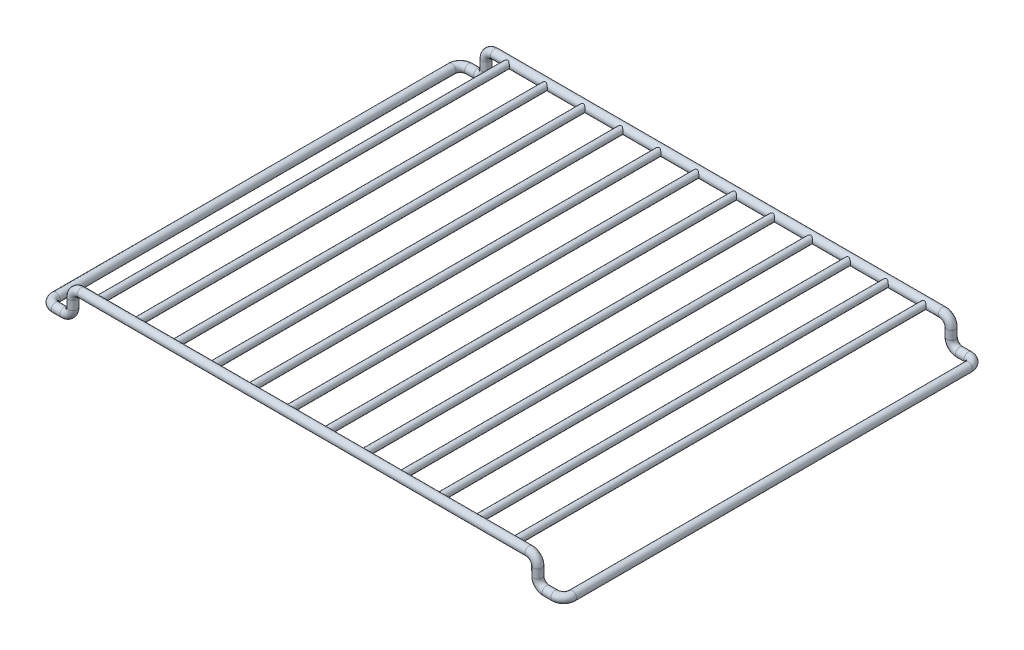
from build123d import *

# Parameters (mm, degrees)
SKETCH1_R                = 2.5
BOSS_EXTRUDE1_REACH      = 289
BOSS_EXTRUDE1_END_RADIUS = 2.5
SKETCH2_R                = 2
LPATTERN1_COUNT          = 6
LPATTERN1_PITCH          = 22


with BuildPart() as part:
    # Sweep1: sweep along a curve in space
    with BuildLine() as sweep1_path:
        Line((0, 0, 0), (130, 0, 0))
        ThreePointArc((130, 0, 0), (133.535533906, -1.464466094, 0), (135, -5, 0))
        Line((135, -5, 0), (135, -10, 0))
        ThreePointArc((135, -10, 0), (136.464466094, -13.535533906, 0), (140, -15, 0))
        Line((140, -15, 0), (145, -15, 0))
        ThreePointArc((145, -15, 0), (148.535533906, -15, 1.464466094), (150, -15, 5))
        Line((150, -15, 5), (150, -15, 235))
        ThreePointArc((150, -15, 235), (148.535533906, -15, 238.535533906), (145, -15, 240))
        Line((145, -15, 240), (140, -15, 240))
        ThreePointArc((140, -15, 240), (136.464466094, -13.535533906, 240), (135, -10, 240))
        Line((135, -10, 240), (135, -5, 240))
        ThreePointArc((135, -5, 240), (133.535533906, -1.464466094, 240), (130, 0, 240))
        Line((130, 0, 240), (0, 0, 240))
    # Sketch1 → Sweep1 (sweep)
    with BuildSketch(Plane(origin=(0, 0, 0), x_dir=(0, 0, -1), z_dir=(1, 0, 0))):
        Circle(SKETCH1_R)
    sweep(path=sweep1_path.line)

    # Boss-Extrude1: up to this cylinder (the profile starts outside it)
    boss_extrude1_end = Plane(origin=(11, 0, 240), z_dir=(-1, 0, 0)) * Cylinder(BOSS_EXTRUDE1_END_RADIUS, 584, mode=Mode.PRIVATE)
    # Sketch2 → Boss-Extrude1 (add, up to the surface)
    with BuildSketch(Plane.XY, mode=Mode.PRIVATE) as boss_extrude1_sk1:
        with Locations(Location((11, 0, 0), (0, 0, 180))):
            Circle(SKETCH2_R)
    boss_extrude1_tool1 = extrude(boss_extrude1_sk1.sketch, amount=BOSS_EXTRUDE1_REACH, mode=Mode.PRIVATE) - boss_extrude1_end
    boss_extrude1 = boss_extrude1_tool1.solids().sort_by_distance((11, 0, 0))[0]
    add(boss_extrude1)

    # LPattern1: Boss-Extrude1 ×6
    with Locations(*[(i * LPATTERN1_PITCH, 0, 0) for i in range(1, LPATTERN1_COUNT)]):
        add(boss_extrude1)

    # Mirror1: part across plane


with BuildPart() as part_1:
    add(part.part)
    add(part.part.mirror(Plane(origin=(0, 0, 240), x_dir=(0, 0, 1), z_dir=(-1, 0, 0))))


solid = part_1.part
